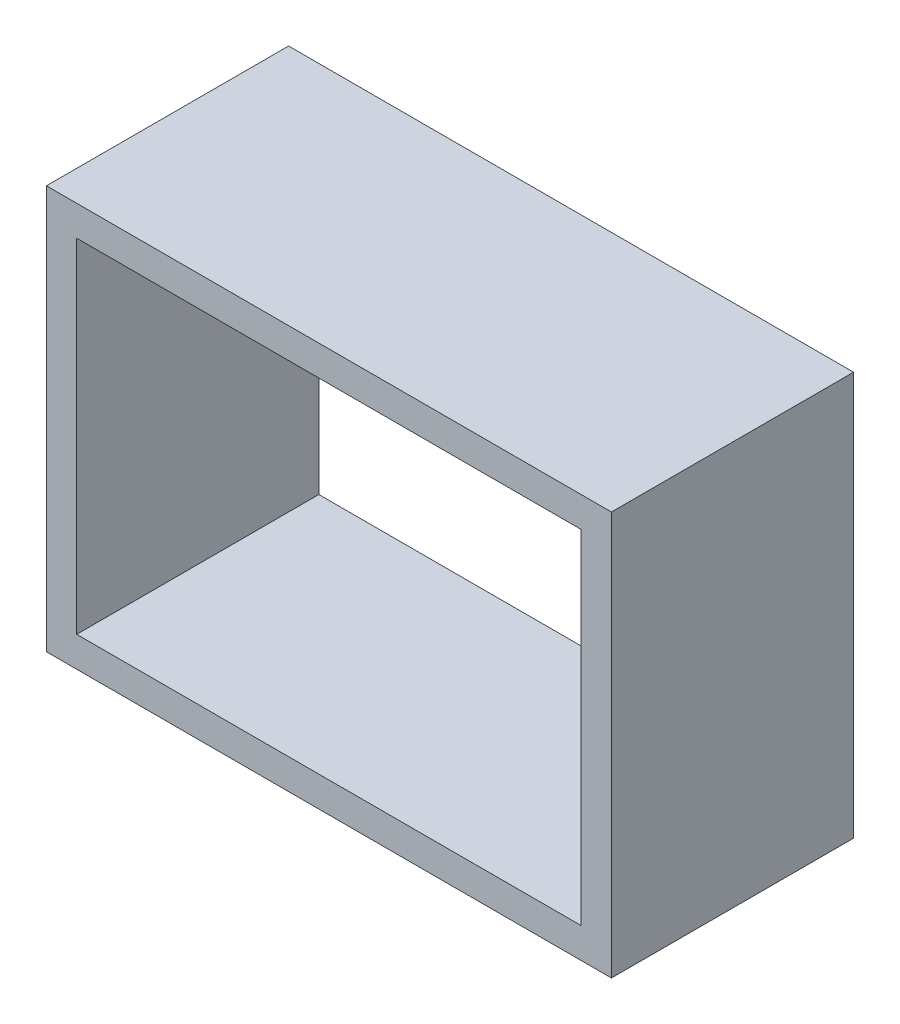
from build123d import *

# Parameters (mm, degrees)
SKETCH_1_W          = 280
SKETCH_1_H          = 200
EXTRUDE_1_DEPTH     = 120
SKETCH_2_W          = 250
SKETCH_2_H          = 170
CUT_EXTRUDE_1_DEPTH = 120


with BuildPart() as part:
    # 草图1 → 凸台-拉伸1 (new body)
    with BuildSketch(Plane.XY):
        with Locations((140, -100)):
            Rectangle(SKETCH_1_W, SKETCH_1_H)
    extrude(amount=EXTRUDE_1_DEPTH)

    # 草图2 → 切除-拉伸1 (cut)
    with BuildSketch(Plane(origin=(0, 0, 0), x_dir=(-1, 0, 0), z_dir=(0, 0, -1))):
        with Locations((-140, -100)):
            Rectangle(SKETCH_2_W, SKETCH_2_H)
    extrude(amount=-CUT_EXTRUDE_1_DEPTH, mode=Mode.SUBTRACT)


solid = part.part
